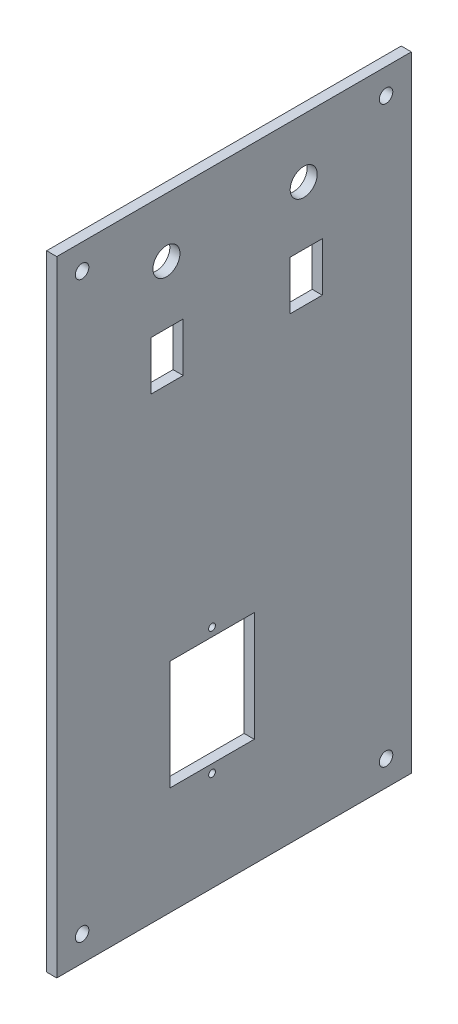
from build123d import *

# Parameters (mm, degrees)
SKETCH1_W           = 210
SKETCH1_H           = 370
BOSS_EXTRUDE1_DEPTH = 6
SKETCH2_W           = 50
SKETCH2_H           = 65
SKETCH2_W_2         = 19
SKETCH2_H_2         = 29
CUT_EXTRUDE1_DEPTH  = 10
SKETCH3_R           = 2
CUT_EXTRUDE2_DEPTH  = 10
SKETCH4_R           = 8
CUT_EXTRUDE3_DEPTH  = 10
SKETCH5_R           = 4
CUT_EXTRUDE4_DEPTH  = 12


with BuildPart() as part:
    # Sketch1 → Boss-Extrude1 (new body)
    with BuildSketch(Plane(origin=(0, 0, 0), x_dir=(0, 0, -1), z_dir=(1, 0, 0))):
        with Locations((105, 185)):
            Rectangle(SKETCH1_W, SKETCH1_H)
    extrude(amount=BOSS_EXTRUDE1_DEPTH)

    # Sketch2 → Cut-Extrude1 (cut)
    with BuildSketch(Plane.ZY):
        with Locations((-91.955439439, 96.451615806)):
            Rectangle(SKETCH2_W, SKETCH2_H)
        with Locations((-147.762028201, 286.067321943)):
            Rectangle(SKETCH2_W_2, SKETCH2_H_2)
        with Locations((-65.37786445, 286.067321943)):
            Rectangle(SKETCH2_W_2, SKETCH2_H_2)
    extrude(amount=-CUT_EXTRUDE1_DEPTH, mode=Mode.SUBTRACT)

    # Sketch3 → Cut-Extrude2 (cut)
    with BuildSketch(Plane.ZY):
        with Locations((-91.955439439, 133.951615806)):
            Circle(SKETCH3_R)
        with Locations((-91.955439439, 58.951615806)):
            Circle(SKETCH3_R)
    extrude(amount=-CUT_EXTRUDE2_DEPTH, mode=Mode.SUBTRACT)

    # Sketch4 → Cut-Extrude3 (cut)
    with BuildSketch(Plane(origin=(6, 0, 0), x_dir=(0, 0, -1), z_dir=(1, 0, 0))):
        with Locations((146.241614862, 335.160418709)):
            Circle(SKETCH4_R)
        with Locations((64.956823424, 335.160418709)):
            Circle(SKETCH4_R)
    extrude(amount=-CUT_EXTRUDE3_DEPTH, mode=Mode.SUBTRACT)

    # Sketch5 → Cut-Extrude4 (cut)
    with BuildSketch(Plane(origin=(6, 0, 0), x_dir=(0, 0, -1), z_dir=(1, 0, 0))):
        with Locations((15.00004659, 15.105743091)):
            Circle(SKETCH5_R)
        with Locations((15.00009318, 355.052871545)):
            Circle(SKETCH5_R)
        with Locations((195.00004659, 355)):
            Circle(SKETCH5_R)
        with Locations((195, 15.017639421)):
            Circle(SKETCH5_R)
    extrude(amount=-CUT_EXTRUDE4_DEPTH, mode=Mode.SUBTRACT)


solid = part.part
